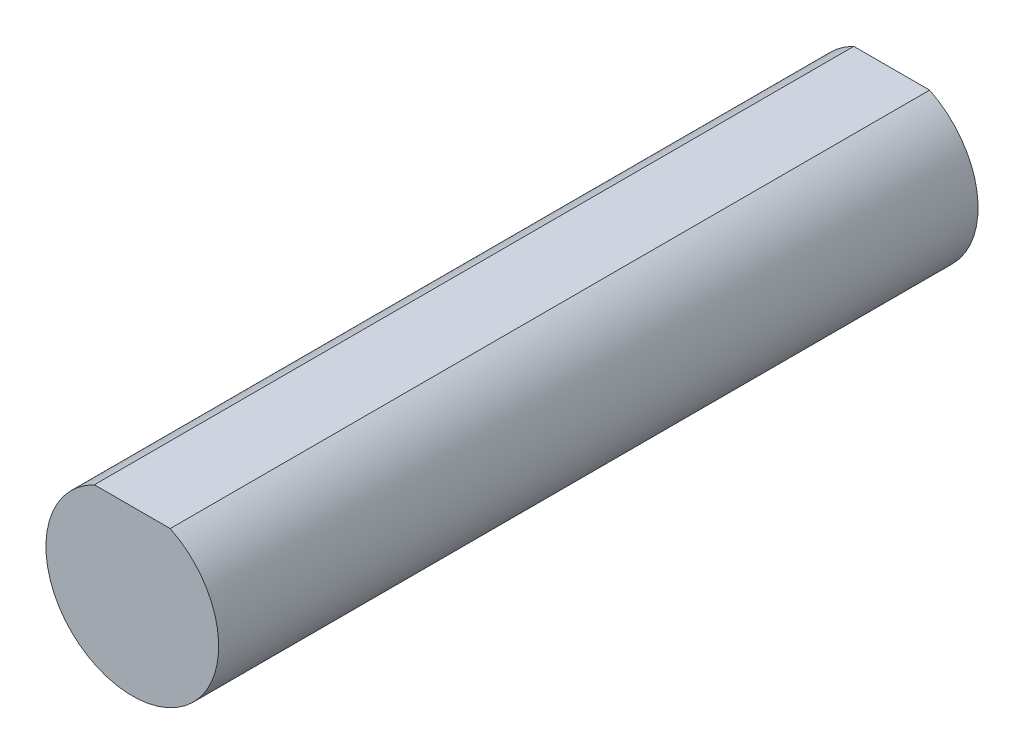
from build123d import *

# Parameters (mm, degrees)
SKETCH1_R           = 2.5019
BOSS_EXTRUDE1_DEPTH = 21.9964
CUT_EXTRUDE5_START  = -21.9964
CUT_EXTRUDE5_DEPTH  = 21.9964


with BuildPart() as part:
    # Sketch1 → Boss-Extrude1 (new body)
    with BuildSketch(Plane.XY):
        Circle(SKETCH1_R)
    extrude(amount=BOSS_EXTRUDE1_DEPTH)

    # Sketch3 → Cut-Extrude5 (cut)
    with BuildSketch(Plane.XY.offset(21.9964).offset(CUT_EXTRUDE5_START)):
        with BuildLine():
            Line((-1.098384814, 2.2479), (1.098384814, 2.2479))
            ThreePointArc((1.098384814, 2.2479), (0, 2.5019), (-1.098384814, 2.2479))
        make_face()
    extrude(amount=CUT_EXTRUDE5_DEPTH, mode=Mode.SUBTRACT)


solid = part.part
